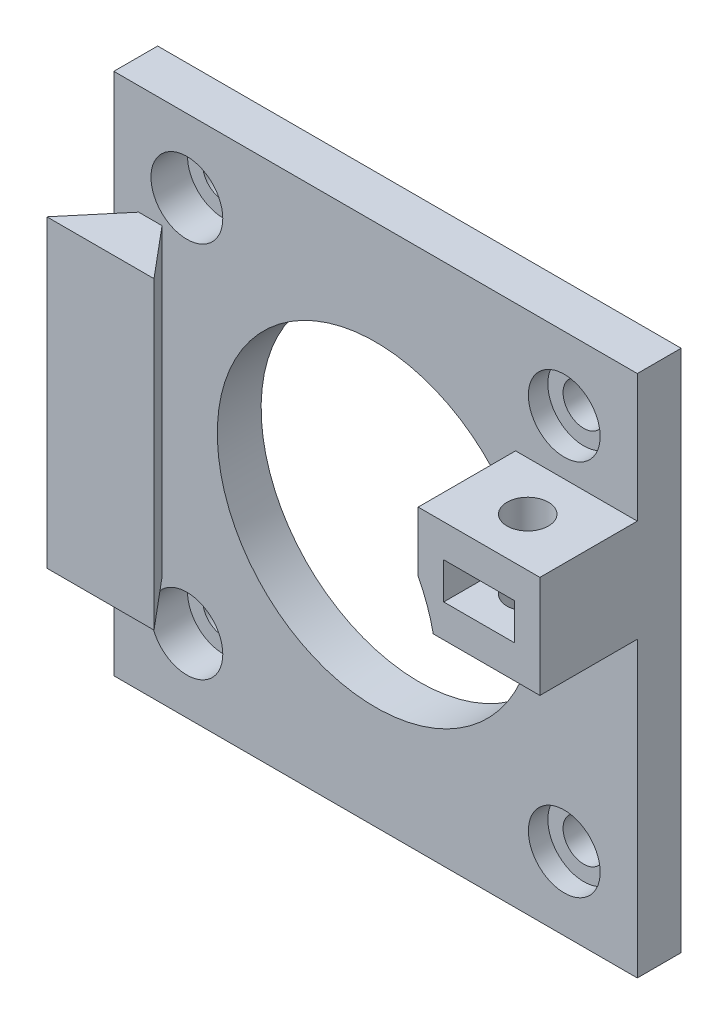
from build123d import *

# Parameters (mm, degrees)
CROQUIS1_W                   = 43
CROQUIS1_H                   = 43
CROQUIS1_R                   = 13
CROQUIS1_R_2                 = 1.7
SALIENTE_EXTRUIR1_DEPTH      = 3.6
CROQUIS2_R                   = 2.95
CORTAR_EXTRUIR1_DEPTH        = 1.6
SALIENTE_EXTRUIR2_DEPTH      = 8
CROQUIS4_R                   = 1.7
CORTAR_EXTRUIR2_DEPTH        = 10
CORTAR_EXTRUIR3_DEPTH        = 1.5
CORTAR_EXTRUIR3_DEPTH_BACK   = 1.5
SALIENTE_EXTRUIR3_DEPTH      = 12.5
SALIENTE_EXTRUIR3_DEPTH_BACK = 12.5
CROQUIS8_R                   = 2.95
CORTAR_EXTRUIR4_DEPTH        = 3


with BuildPart() as part:
    # Croquis1 → Saliente-Extruir1 (new body)
    with BuildSketch(Plane.XY):
        Rectangle(CROQUIS1_W, CROQUIS1_H)
        Circle(CROQUIS1_R, mode=Mode.SUBTRACT)
        with Locations((-15.5, 15.5)):
            Circle(CROQUIS1_R_2, mode=Mode.SUBTRACT)
        with Locations((-15.5, -15.5)):
            Circle(CROQUIS1_R_2, mode=Mode.SUBTRACT)
        with Locations((15.5, -15.5)):
            Circle(CROQUIS1_R_2, mode=Mode.SUBTRACT)
        with Locations((15.5, 15.5)):
            Circle(CROQUIS1_R_2, mode=Mode.SUBTRACT)
    extrude(amount=SALIENTE_EXTRUIR1_DEPTH)

    # Croquis2 → Cortar-Extruir1 (cut)
    with BuildSketch(Plane.XY.offset(3.6)):
        with Locations((-15.5, 15.5)):
            Circle(CROQUIS2_R)
        with Locations((15.5, 15.5)):
            Circle(CROQUIS2_R)
        with Locations((-15.5, -15.5)):
            Circle(CROQUIS2_R)
        with Locations((15.5, -15.5)):
            Circle(CROQUIS2_R)
    extrude(amount=-CORTAR_EXTRUIR1_DEPTH, mode=Mode.SUBTRACT)

    # Croquis3 → Saliente-Extruir2 (add)
    with BuildSketch(Plane.XY.offset(3.6)):
        with BuildLine():
            Line((21.5, 2.6), (12.737346662, 2.6))
            ThreePointArc((12.737346662, 2.6), (12.241687471, 4.375052899), (11.5, 6.062177826))
            Line((11.5, 6.062177826), (11.5, 11))
            Line((11.5, 11), (21.5, 11))
            Line((21.5, 11), (21.5, 2.6))
        make_face()
    extrude(amount=SALIENTE_EXTRUIR2_DEPTH)

    # Croquis4 → Cortar-Extruir2 (cut)
    with BuildSketch(Plane.XZ.offset(-2.6)):
        with Locations((16.5, 7.6)):
            Circle(CROQUIS4_R)
    extrude(amount=-CORTAR_EXTRUIR2_DEPTH, mode=Mode.SUBTRACT)

    # Croquis6 → Cortar-Extruir3 (cut, two sides: drawn at the far end of the back side and taken through both)
    with BuildSketch(Plane(origin=(0, 6.8, 0), x_dir=(-1, 0, 0), z_dir=(0, -1, 0)).offset(-CORTAR_EXTRUIR3_DEPTH_BACK)):
        Polygon((-13.598814897, -9.275), (-13.598814897, -15.925), (-19.401185103, -15.925), (-19.401185103, -9.275), (-19.401185103, -5.925), (-16.5, -4.25), (-13.598814897, -5.925), align=None)
    extrude(amount=CORTAR_EXTRUIR3_DEPTH + CORTAR_EXTRUIR3_DEPTH_BACK, mode=Mode.SUBTRACT)

    # Croquis7 → Saliente-Extruir3 (add, two sides: drawn at the far end of the back side and taken through both)
    with BuildSketch(Plane(origin=(0, 0, 0), x_dir=(1, 0, 0), z_dir=(0, 1, 0)).offset(-SALIENTE_EXTRUIR3_DEPTH_BACK)):
        Polygon((-22.9, -7.7), (-18.5, -2.456284193), (-14.1, -7.7), align=None)
    extrude(amount=SALIENTE_EXTRUIR3_DEPTH + SALIENTE_EXTRUIR3_DEPTH_BACK)

    # Croquis8 → Cortar-Extruir4 (cut)
    with BuildSketch(Plane.XY.offset(3.6)):
        with Locations((-15.5, -15.5)):
            Circle(CROQUIS8_R)
        with Locations((-15.5, 15.5)):
            Circle(CROQUIS8_R)
    extrude(amount=-CORTAR_EXTRUIR4_DEPTH, mode=Mode.SUBTRACT)


solid = part.part
